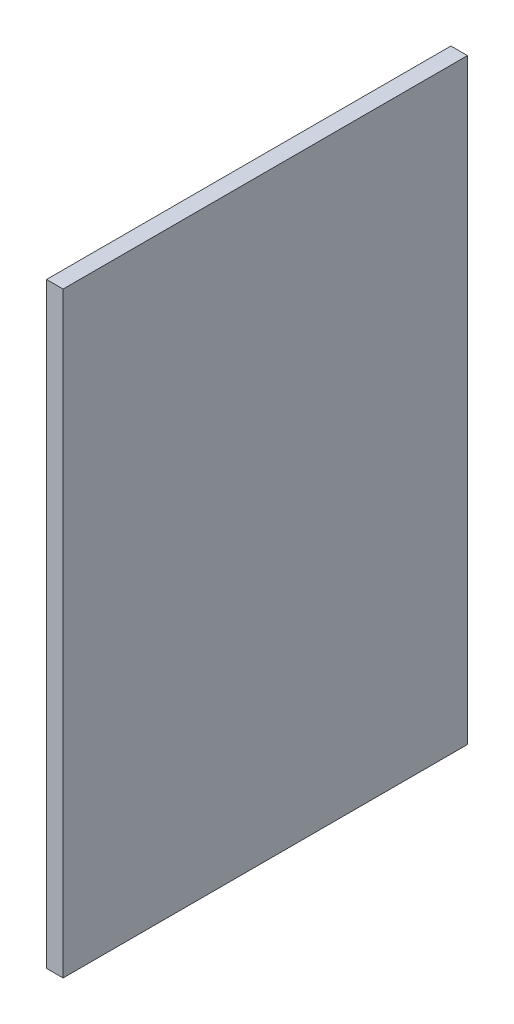
from build123d import *

# Parameters (mm, degrees)
SKETCH1_W           = 77.47
SKETCH1_H           = 114.3
BOSS_EXTRUDE1_DEPTH = 3.175


with BuildPart() as part:
    # Sketch1 → Boss-Extrude1 (new body)
    with BuildSketch(Plane(origin=(0, 0, 0), x_dir=(0, 0, -1), z_dir=(1, 0, 0))):
        with Locations((38.735, 57.15)):
            Rectangle(SKETCH1_W, SKETCH1_H)
    extrude(amount=BOSS_EXTRUDE1_DEPTH)


solid = part.part
